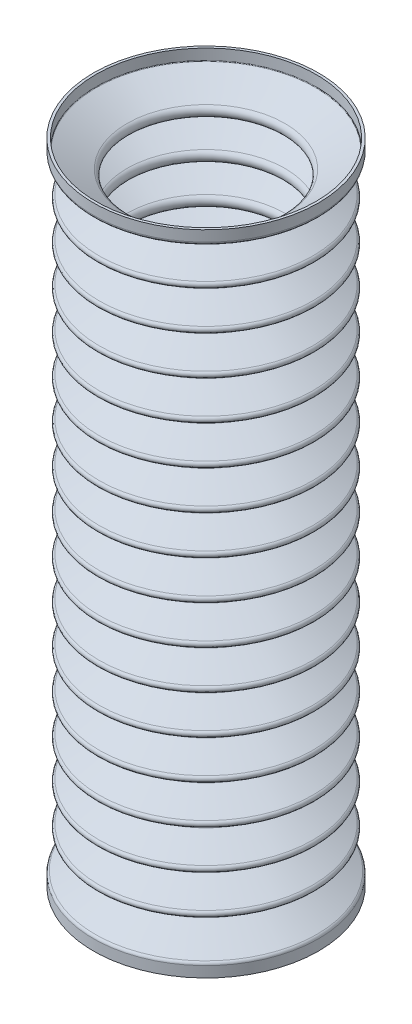
from build123d import *

# Parameters (mm, degrees)
SHELL1_T = -1.1938


with BuildPart() as part:
    # Sketch1 → Revolve2 (revolve)
    with BuildSketch(Plane.XY):
        with BuildLine():
            Line((0, 0), (0, 304.8))
            Line((0, 304.8), (52.959, 304.8))
            Line((52.959, 304.8), (52.959, 299.763614837))
            ThreePointArc((52.959, 299.763614837), (52.734914914, 298.968129315), (52.128557459, 298.406576131))
            Line((52.128557459, 298.406576131), (37.707229247, 291.036101206))
            ThreePointArc((37.707229247, 291.036101206), (36.876786706, 289.6790625), (37.707229247, 288.322023794))
            Line((37.707229247, 288.322023794), (50.303770753, 281.884163706))
            ThreePointArc((50.303770753, 281.884163706), (51.134213294, 280.527125), (50.303770753, 279.170086294))
            Line((50.303770753, 279.170086294), (37.707229247, 272.732226206))
            ThreePointArc((37.707229247, 272.732226206), (36.876786706, 271.3751875), (37.707229247, 270.018148794))
            Line((37.707229247, 270.018148794), (50.303770753, 263.580288706))
            ThreePointArc((50.303770753, 263.580288706), (51.134213294, 262.22325), (50.303770753, 260.866211294))
            Line((50.303770753, 260.866211294), (37.707229247, 254.428351206))
            ThreePointArc((37.707229247, 254.428351206), (36.876786706, 253.0713125), (37.707229247, 251.714273794))
            Line((37.707229247, 251.714273794), (50.303770753, 245.276413706))
            ThreePointArc((50.303770753, 245.276413706), (51.134213294, 243.919375), (50.303770753, 242.562336294))
            Line((50.303770753, 242.562336294), (37.707229247, 236.124476206))
            ThreePointArc((37.707229247, 236.124476206), (36.876786706, 234.7674375), (37.707229247, 233.410398794))
            Line((37.707229247, 233.410398794), (50.303770753, 226.972538706))
            ThreePointArc((50.303770753, 226.972538706), (51.134213294, 225.6155), (50.303770753, 224.258461294))
            Line((50.303770753, 224.258461294), (37.707229247, 217.820601206))
            ThreePointArc((37.707229247, 217.820601206), (36.876786706, 216.4635625), (37.707229247, 215.106523794))
            Line((37.707229247, 215.106523794), (50.303770753, 208.668663706))
            ThreePointArc((50.303770753, 208.668663706), (51.134213294, 207.311625), (50.303770753, 205.954586294))
            Line((50.303770753, 205.954586294), (37.707229247, 199.516726206))
            ThreePointArc((37.707229247, 199.516726206), (36.876786706, 198.1596875), (37.707229247, 196.802648794))
            Line((37.707229247, 196.802648794), (50.303770753, 190.364788706))
            ThreePointArc((50.303770753, 190.364788706), (51.134213294, 189.00775), (50.303770753, 187.650711294))
            Line((50.303770753, 187.650711294), (37.707229247, 181.212851206))
            ThreePointArc((37.707229247, 181.212851206), (36.876786706, 179.8558125), (37.707229247, 178.498773794))
            Line((37.707229247, 178.498773794), (50.303770753, 172.060913706))
            ThreePointArc((50.303770753, 172.060913706), (51.134213294, 170.703875), (50.303770753, 169.346836294))
            Line((50.303770753, 169.346836294), (37.707229247, 162.908976206))
            ThreePointArc((37.707229247, 162.908976206), (36.876786706, 161.5519375), (37.707229247, 160.194898794))
            Line((37.707229247, 160.194898794), (50.303770753, 153.757038706))
            ThreePointArc((50.303770753, 153.757038706), (51.134213294, 152.4), (50.303770753, 151.042961294))
            Line((50.303770753, 151.042961294), (37.707229247, 144.605101206))
            ThreePointArc((37.707229247, 144.605101206), (36.876786706, 143.2480625), (37.707229247, 141.891023794))
            Line((37.707229247, 141.891023794), (50.303770753, 135.453163706))
            ThreePointArc((50.303770753, 135.453163706), (51.134213294, 134.096125), (50.303770753, 132.739086294))
            Line((50.303770753, 132.739086294), (37.707229247, 126.301226206))
            ThreePointArc((37.707229247, 126.301226206), (36.876786706, 124.9441875), (37.707229247, 123.587148794))
            Line((37.707229247, 123.587148794), (50.303770753, 117.149288706))
            ThreePointArc((50.303770753, 117.149288706), (51.134213294, 115.79225), (50.303770753, 114.435211294))
            Line((50.303770753, 114.435211294), (37.707229247, 107.997351206))
            ThreePointArc((37.707229247, 107.997351206), (36.876786706, 106.6403125), (37.707229247, 105.283273794))
            Line((37.707229247, 105.283273794), (50.303770753, 98.845413706))
            ThreePointArc((50.303770753, 98.845413706), (51.134213294, 97.488375), (50.303770753, 96.131336294))
            Line((50.303770753, 96.131336294), (37.707229247, 89.693476206))
            ThreePointArc((37.707229247, 89.693476206), (36.876786706, 88.3364375), (37.707229247, 86.979398794))
            Line((37.707229247, 86.979398794), (50.303770753, 80.541538706))
            ThreePointArc((50.303770753, 80.541538706), (51.134213294, 79.1845), (50.303770753, 77.827461294))
            Line((50.303770753, 77.827461294), (37.707229247, 71.389601206))
            ThreePointArc((37.707229247, 71.389601206), (36.876786706, 70.0325625), (37.707229247, 68.675523794))
            Line((37.707229247, 68.675523794), (50.303770753, 62.237663706))
            ThreePointArc((50.303770753, 62.237663706), (51.134213294, 60.880625), (50.303770753, 59.523586294))
            Line((50.303770753, 59.523586294), (37.707229247, 53.085726206))
            ThreePointArc((37.707229247, 53.085726206), (36.876786706, 51.7286875), (37.707229247, 50.371648794))
            Line((37.707229247, 50.371648794), (50.303770753, 43.933788706))
            ThreePointArc((50.303770753, 43.933788706), (51.134213294, 42.57675), (50.303770753, 41.219711294))
            Line((50.303770753, 41.219711294), (37.707229247, 34.781851206))
            ThreePointArc((37.707229247, 34.781851206), (36.876786706, 33.4248125), (37.707229247, 32.067773794))
            Line((37.707229247, 32.067773794), (50.303770753, 25.629913706))
            ThreePointArc((50.303770753, 25.629913706), (51.134213294, 24.272875), (50.303770753, 22.915836294))
            Line((50.303770753, 22.915836294), (37.707229247, 16.477976206))
            ThreePointArc((37.707229247, 16.477976206), (36.876786706, 15.1209375), (37.707229247, 13.763898794))
            Line((37.707229247, 13.763898794), (52.128557459, 6.393423869))
            ThreePointArc((52.128557459, 6.393423869), (52.734914914, 5.831870685), (52.959, 5.036385163))
            Line((52.959, 5.036385163), (52.959, 0))
            Line((52.959, 0), (0, 0))
        make_face()
    revolve(axis=Axis((0, 0, 0), (0, 1, 0)))

    # Shell1
    shell1_openings = [part.faces().sort_by_distance(p)[0] for p in [
        (0, 0, 0),
        (0, 304.8, 0),
    ]]
    offset(amount=SHELL1_T, openings=shell1_openings, kind=Kind.INTERSECTION)


solid = part.part
